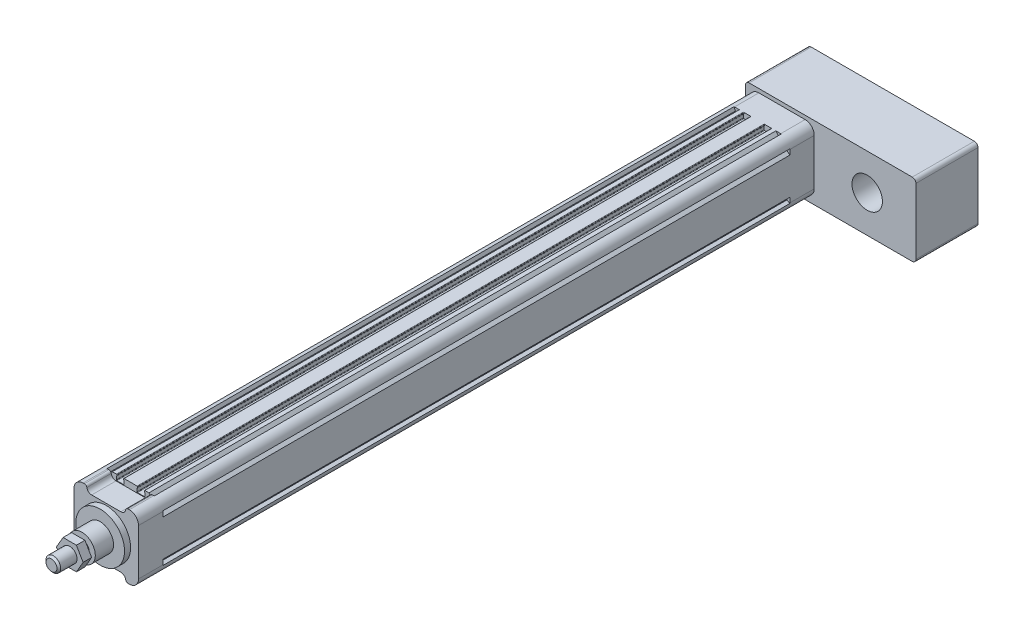
from build123d import *

# Parameters (mm, degrees)
SKETCH_1_R                  = 2.1
EXTRUDE_1_DEPTH             = 515
EXTRUDE_2_DEPTH             = 20
SKETCH_7_R                  = 20
EXTRUDE_3_DEPTH             = 5
SKETCH_9_R                  = 11
EXTRUDE_4_DEPTH             = 15
SKETCH_10_R                 = 6
EXTRUDE_5_DEPTH             = 25
EXTRUDE_START               = 20
EXTRUDE_6_DEPTH             = 20
EXTRUDE_7_DEPTH             = 51
SKETCH_13_R                 = 12.5
CUT_EXTRUDE_2_DEPTH         = 30
PATTERN_LINEAR_1_COUNT      = 2
PATTERN_LINEAR_1_PITCH      = 38
PATTERN_LINEAR_1_COUNT_DIR2 = 2
PATTERN_LINEAR_1_PITCH_DIR2 = 38
HOLE_WIZARD_M6_2_D          = 5
HOLE_WIZARD_M6_2_DEPTH      = 15
HOLE_WIZARD_M6_2_TIP        = 1.502151548
HOLE_WIZARD_M6_3_D          = 5
HOLE_WIZARD_M6_3_DEPTH      = 15
HOLE_WIZARD_M6_3_TIP        = 1.502151548
HOLE_WIZARD_M6_4_D          = 5
HOLE_WIZARD_M6_4_DEPTH      = 15
HOLE_WIZARD_M6_4_TIP        = 1.502151548
CHAMFER_1_SIZE              = 1.5
EXTRUDE_START_2             = 3
EXTRUDE_8_DEPTH             = 7


with BuildPart() as part:
    # 草图1 → 凸台-拉伸1 (new body)
    with BuildSketch(Plane.XY):
        with BuildLine():
            Line((-18.2, 24), (-19.443439638, 26.486879276))
            ThreePointArc((-19.443439638, 26.486879276), (-24.303300859, 24.303300859), (-26.486879276, 19.443439638))
            Line((-26.486879276, 19.443439638), (-24, 18.2))
            Line((-24, 18.2), (-24, 17.1))
            Line((-24, 17.1), (-26.5, 15))
            Line((-26.5, 15), (-26.5, -15))
            Line((-26.5, -15), (-24, -17.1))
            Line((-24, -17.1), (-24, -18.2))
            Line((-24, -18.2), (-26.486879276, -19.443439638))
            ThreePointArc((-26.486879276, -19.443439638), (-24.303300859, -24.303300859), (-19.443439638, -26.486879276))
            Line((-19.443439638, -26.486879276), (-18.2, -24))
            Line((-18.2, -24), (-17.1, -24))
            Line((-17.1, -24), (-15, -26.5))
            Line((-15, -26.5), (-11.65, -26.5))
            ThreePointArc((-11.65, -26.5), (-11.367157288, -26.382842712), (-11.25, -26.1))
            Line((-11.25, -26.1), (-11.25, -25.6))
            ThreePointArc((-11.25, -25.6), (-11.367157288, -25.317157288), (-11.65, -25.2))
            Line((-11.65, -25.2), (-11.75, -25.2))
            Line((-11.75, -25.2), (-11.75, -22.4))
            ThreePointArc((-11.75, -22.4), (-11.632842712, -22.117157288), (-11.35, -22))
            Line((-11.35, -22), (-5.65, -22))
            ThreePointArc((-5.65, -22), (-5.367157288, -22.117157288), (-5.25, -22.4))
            Line((-5.25, -22.4), (-5.25, -25.2))
            Line((-5.25, -25.2), (-5.35, -25.2))
            ThreePointArc((-5.35, -25.2), (-5.632842712, -25.317157288), (-5.75, -25.6))
            Line((-5.75, -25.6), (-5.75, -26.1))
            ThreePointArc((-5.75, -26.1), (-5.632842712, -26.382842712), (-5.35, -26.5))
            Line((-5.35, -26.5), (5.35, -26.5))
            ThreePointArc((5.35, -26.5), (5.632842712, -26.382842712), (5.75, -26.1))
            Line((5.75, -26.1), (5.75, -25.6))
            ThreePointArc((5.75, -25.6), (5.632842712, -25.317157288), (5.35, -25.2))
            Line((5.35, -25.2), (5.25, -25.2))
            Line((5.25, -25.2), (5.25, -22.4))
            ThreePointArc((5.25, -22.4), (5.367157288, -22.117157288), (5.65, -22))
            Line((5.65, -22), (11.35, -22))
            ThreePointArc((11.35, -22), (11.632842712, -22.117157288), (11.75, -22.4))
            Line((11.75, -22.4), (11.75, -25.2))
            Line((11.75, -25.2), (11.65, -25.2))
            ThreePointArc((11.65, -25.2), (11.367157288, -25.317157288), (11.25, -25.6))
            Line((11.25, -25.6), (11.25, -26.1))
            ThreePointArc((11.25, -26.1), (11.367157288, -26.382842712), (11.65, -26.5))
            Line((11.65, -26.5), (15, -26.5))
            Line((15, -26.5), (17.1, -24))
            Line((17.1, -24), (18.2, -24))
            Line((18.2, -24), (19.443439638, -26.486879276))
            ThreePointArc((19.443439638, -26.486879276), (24.303300859, -24.303300859), (26.486879276, -19.443439638))
            Line((26.486879276, -19.443439638), (24, -18.2))
            Line((24, -18.2), (24, -17.1))
            Line((24, -17.1), (26.5, -15))
            Line((26.5, -15), (26.5, 15))
            Line((26.5, 15), (24, 17.1))
            Line((24, 17.1), (24, 18.2))
            Line((24, 18.2), (26.486879276, 19.443439638))
            ThreePointArc((26.486879276, 19.443439638), (24.303300859, 24.303300859), (19.443439638, 26.486879276))
            Line((19.443439638, 26.486879276), (18.2, 24))
            Line((18.2, 24), (17.1, 24))
            Line((17.1, 24), (15, 26.5))
            Line((15, 26.5), (11.65, 26.5))
            ThreePointArc((11.65, 26.5), (11.367157288, 26.382842712), (11.25, 26.1))
            Line((11.25, 26.1), (11.25, 25.6))
            ThreePointArc((11.25, 25.6), (11.367157288, 25.317157288), (11.65, 25.2))
            Line((11.65, 25.2), (11.75, 25.2))
            Line((11.75, 25.2), (11.75, 22.4))
            ThreePointArc((11.75, 22.4), (11.632842712, 22.117157288), (11.35, 22))
            Line((11.35, 22), (5.65, 22))
            ThreePointArc((5.65, 22), (5.367157288, 22.117157288), (5.25, 22.4))
            Line((5.25, 22.4), (5.25, 25.2))
            Line((5.25, 25.2), (5.35, 25.2))
            ThreePointArc((5.35, 25.2), (5.632842712, 25.317157288), (5.75, 25.6))
            Line((5.75, 25.6), (5.75, 26.1))
            ThreePointArc((5.75, 26.1), (5.632842712, 26.382842712), (5.35, 26.5))
            Line((5.35, 26.5), (-5.35, 26.5))
            ThreePointArc((-5.35, 26.5), (-5.632842712, 26.382842712), (-5.75, 26.1))
            Line((-5.75, 26.1), (-5.75, 25.6))
            ThreePointArc((-5.75, 25.6), (-5.632842712, 25.317157288), (-5.35, 25.2))
            Line((-5.35, 25.2), (-5.25, 25.2))
            Line((-5.25, 25.2), (-5.25, 22.4))
            ThreePointArc((-5.25, 22.4), (-5.367157288, 22.117157288), (-5.65, 22))
            Line((-5.65, 22), (-11.35, 22))
            ThreePointArc((-11.35, 22), (-11.632842712, 22.117157288), (-11.75, 22.4))
            Line((-11.75, 22.4), (-11.75, 25.2))
            Line((-11.75, 25.2), (-11.65, 25.2))
            ThreePointArc((-11.65, 25.2), (-11.367157288, 25.317157288), (-11.25, 25.6))
            Line((-11.25, 25.6), (-11.25, 26.1))
            ThreePointArc((-11.25, 26.1), (-11.367157288, 26.382842712), (-11.65, 26.5))
            Line((-11.65, 26.5), (-15, 26.5))
            Line((-15, 26.5), (-17.1, 24))
            Line((-17.1, 24), (-18.2, 24))
        make_face()
        with Locations((19, 19)):
            Circle(SKETCH_1_R, mode=Mode.SUBTRACT)
        with Locations((19, -19)):
            Circle(SKETCH_1_R, mode=Mode.SUBTRACT)
        with Locations((-19, -19)):
            Circle(SKETCH_1_R, mode=Mode.SUBTRACT)
        with Locations((-19, 19)):
            Circle(SKETCH_1_R, mode=Mode.SUBTRACT)
        with BuildLine():
            Line((19.773719933, 3), (23.3, 3))
            Line((23.3, 3), (23.3, -3))
            Line((23.3, -3), (19.773719933, -3))
            ThreePointArc((19.773719933, -3), (0, -20), (-19.773719933, -3))
            Line((-19.773719933, -3), (-23.3, -3))
            Line((-23.3, -3), (-23.3, 3))
            Line((-23.3, 3), (-19.773719933, 3))
            ThreePointArc((-19.773719933, 3), (0, 20), (19.773719933, 3))
        make_face(mode=Mode.SUBTRACT)
    extrude(amount=EXTRUDE_1_DEPTH)

    # 草图6 → 凸台-拉伸2 (add)
    with BuildSketch(Plane.XY.offset(515)):
        with BuildLine():
            Line((-26.5, -19), (-26.5, 19))
            ThreePointArc((-26.5, 19), (-24.303300859, 24.303300859), (-19, 26.5))
            Line((-19, 26.5), (-17.916079783, 26.5))
            ThreePointArc((-17.916079783, 26.5), (-16.625085334, 26.027525232), (-15.944053189, 24.833333333))
            ThreePointArc((-15.944053189, 24.833333333), (-14.581988897, 22.444949537), (-12, 21.5))
            Line((-12, 21.5), (12, 21.5))
            ThreePointArc((12, 21.5), (14.581988897, 22.444949537), (15.944053189, 24.833333333))
            ThreePointArc((15.944053189, 24.833333333), (16.625085334, 26.027525232), (17.916079783, 26.5))
            Line((17.916079783, 26.5), (19, 26.5))
            ThreePointArc((19, 26.5), (24.303300859, 24.303300859), (26.5, 19))
            Line((26.5, 19), (26.5, -19))
            ThreePointArc((26.5, -19), (24.303300859, -24.303300859), (19, -26.5))
            Line((19, -26.5), (17.916079783, -26.5))
            ThreePointArc((17.916079783, -26.5), (16.625085334, -26.027525232), (15.944053189, -24.833333333))
            ThreePointArc((15.944053189, -24.833333333), (14.581988897, -22.444949537), (12, -21.5))
            Line((12, -21.5), (-12, -21.5))
            ThreePointArc((-12, -21.5), (-14.581988897, -22.444949537), (-15.944053189, -24.833333333))
            ThreePointArc((-15.944053189, -24.833333333), (-16.625085334, -26.027525232), (-17.916079783, -26.5))
            Line((-17.916079783, -26.5), (-19, -26.5))
            ThreePointArc((-19, -26.5), (-24.303300859, -24.303300859), (-26.5, -19))
        make_face()
    extrude(amount=EXTRUDE_2_DEPTH)

    # 草图7 → 凸台-拉伸3 (add)
    with BuildSketch(Plane.XY.offset(535)):
        Circle(SKETCH_7_R)
    extrude(amount=EXTRUDE_3_DEPTH)

    # 草图9 → 凸台-拉伸4 (add)
    with BuildSketch(Plane.XY.offset(540)):
        Circle(SKETCH_9_R)
    extrude(amount=EXTRUDE_4_DEPTH)

    # 草图10 → 凸台-拉伸5 (add)
    with BuildSketch(Plane.XY.offset(555)):
        Circle(SKETCH_10_R)
    extrude(amount=EXTRUDE_5_DEPTH)

    # 草图11 → 凸台-拉伸6 (add)
    with BuildSketch(Plane(origin=(0, 0, 0), x_dir=(-1, 0, 0), z_dir=(0, 0, -1)).offset(EXTRUDE_START)):
        with BuildLine():
            Line((-19, -26.5), (19, -26.5))
            ThreePointArc((19, -26.5), (24.303300859, -24.303300859), (26.5, -19))
            Line((26.5, -19), (26.5, 19))
            ThreePointArc((26.5, 19), (24.303300859, 24.303300859), (19, 26.5))
            Line((19, 26.5), (-19, 26.5))
            ThreePointArc((-19, 26.5), (-24.303300859, 24.303300859), (-26.5, 19))
            Line((-26.5, 19), (-26.5, -19))
            ThreePointArc((-26.5, -19), (-24.303300859, -24.303300859), (-19, -26.5))
        make_face()
    extrude(amount=-EXTRUDE_6_DEPTH)

    # 草图12 → 凸台-拉伸7 (add)
    with BuildSketch(Plane(origin=(0, 0, -20), x_dir=(-1, 0, 0), z_dir=(0, 0, -1))):
        with BuildLine():
            Line((-107, -30.404162038), (27, -30.404162038))
            ThreePointArc((27, -30.404162038), (29.121320344, -29.525482382), (30, -27.404162038))
            Line((30, -27.404162038), (30, 26.595837962))
            ThreePointArc((30, 26.595837962), (29.121320344, 28.717158305), (27, 29.595837962))
            Line((27, 29.595837962), (-107, 29.595837962))
            ThreePointArc((-107, 29.595837962), (-109.121320344, 28.717158305), (-110, 26.595837962))
            Line((-110, 26.595837962), (-110, -27.404162038))
            ThreePointArc((-110, -27.404162038), (-109.121320344, -29.525482382), (-107, -30.404162038))
        make_face()
    extrude(amount=EXTRUDE_7_DEPTH)

    # 草图13 → 切除-拉伸2 (cut)
    with BuildSketch(Plane.XY.offset(-20)):
        with Locations((70, 0)):
            Circle(SKETCH_13_R)
    extrude(amount=-CUT_EXTRUDE_2_DEPTH, mode=Mode.SUBTRACT)

    # 草图15 → M6 螺纹孔1 (revolve, cut)
    with BuildSketch(Plane(origin=(-19, -19, -71), x_dir=(0, 1, 0), z_dir=(1, 0, 0))):
        Polygon((0, 0), (0, 16.502151548), (2.5, 15), (2.5, 0), align=None)
    hole_wizard_m6_1 = revolve(axis=Axis((-19, -19, -77.35), (0, 0, 1)), mode=Mode.SUBTRACT)

    # 阵列(线性)1: Hole Wizard M6 _1 2 × 2
    with Locations(*[(j * PATTERN_LINEAR_1_PITCH_DIR2, i * PATTERN_LINEAR_1_PITCH, 0) for i in range(PATTERN_LINEAR_1_COUNT) for j in range(PATTERN_LINEAR_1_COUNT_DIR2) if (i, j) != (0, 0)]):
        add(hole_wizard_m6_1, mode=Mode.SUBTRACT)

    # M6 螺纹孔2
    with Locations(Plane(origin=(0, 0, -71), x_dir=(-1, 0, 0), z_dir=(0, 0, -1))):
        with Locations((-84, -19), (-84, 19)):
            Hole(HOLE_WIZARD_M6_2_D / 2, depth=HOLE_WIZARD_M6_2_DEPTH)
            with Locations((0, 0, -(HOLE_WIZARD_M6_2_DEPTH + HOLE_WIZARD_M6_2_TIP / 2))):  # 118° drill point
                Cone(0, HOLE_WIZARD_M6_2_D / 2, HOLE_WIZARD_M6_2_TIP, mode=Mode.SUBTRACT)

    # M6 螺纹孔3
    with Locations(Plane.ZY.offset(26.5)):
        with Locations((525, 11), (525, -11)):
            Hole(HOLE_WIZARD_M6_3_D / 2, depth=HOLE_WIZARD_M6_3_DEPTH)
            with Locations((0, 0, -(HOLE_WIZARD_M6_3_DEPTH + HOLE_WIZARD_M6_3_TIP / 2))):  # 118° drill point
                Cone(0, HOLE_WIZARD_M6_3_D / 2, HOLE_WIZARD_M6_3_TIP, mode=Mode.SUBTRACT)

    # M6 螺纹孔4
    with Locations(Plane.ZY.offset(26.5)):
        with Locations((-10, 11), (-10, -11)):
            Hole(HOLE_WIZARD_M6_4_D / 2, depth=HOLE_WIZARD_M6_4_DEPTH)
            with Locations((0, 0, -(HOLE_WIZARD_M6_4_DEPTH + HOLE_WIZARD_M6_4_TIP / 2))):  # 118° drill point
                Cone(0, HOLE_WIZARD_M6_4_D / 2, HOLE_WIZARD_M6_4_TIP, mode=Mode.SUBTRACT)

    # 倒角1
    chamfer_1_edges = [part.edges().sort_by_distance(p)[0] for p in [
        (-6, 0, 580),
    ]]
    chamfer(chamfer_1_edges, length=CHAMFER_1_SIZE)

    # 草图23 → 凸台-拉伸8 (add)
    with BuildSketch(Plane.XY.offset(555).offset(EXTRUDE_START_2)):
        Polygon((10.969655115, 0), (5.484827557, 9.5), (-5.484827557, 9.5), (-10.969655115, 0), (-5.484827557, -9.5), (5.484827557, -9.5), align=None)
    extrude(amount=EXTRUDE_8_DEPTH)


solid = part.part
